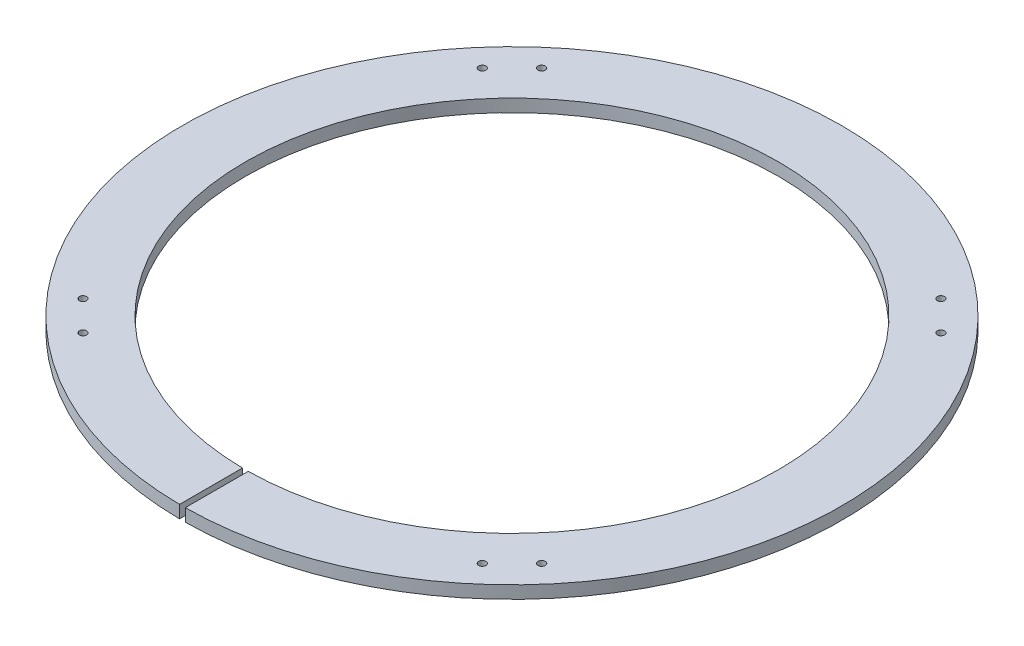
from build123d import *

# Parameters (mm, degrees)
SKETCH1_R           = 314
SKETCH1_R_2         = 254
BOSS_EXTRUDE1_DEPTH = 12
SKETCH2_W           = 5.489817528
SKETCH2_H           = 110.495913403
CUT_EXTRUDE1_DEPTH  = 445.22516813
SKETCH3_R           = 3.45
SCREW_HOLE_DEPTH    = 445.22516813
CIRPATTERN1_COUNT   = 4


with BuildPart() as part:
    # Sketch1 → Boss-Extrude1 (new body)
    with BuildSketch(Plane(origin=(0, 0, 0), x_dir=(1, 0, 0), z_dir=(0, 1, 0))):
        with Locations(Location((0, 0, 0), (0, 0, 270))):
            Circle(SKETCH1_R)
        with Locations(Location((0, 0, 0), (0, 0, 270))):
            Circle(SKETCH1_R_2, mode=Mode.SUBTRACT)
    extrude(amount=BOSS_EXTRUDE1_DEPTH)

    # Sketch2 → Cut-Extrude1 (cut, through all)
    with BuildSketch(Plane(origin=(0, 12, 0), x_dir=(1, 0, 0), z_dir=(0, 1, 0))):
        with Locations((0, -289.886753328)):
            Rectangle(SKETCH2_W, SKETCH2_H)
    extrude(amount=-CUT_EXTRUDE1_DEPTH, mode=Mode.SUBTRACT)

    # Sketch3 → screw hole (cut, through all)
    with BuildSketch(Plane(origin=(0, 12, 0), x_dir=(1, 0, 0), z_dir=(0, 1, 0))):
        with Locations(Location((190.211724139, -218.495995387, 0), (0, 0, 270))):
            Circle(SKETCH3_R)
        with Locations(Location((218.495995387, -190.211724139, 0), (0, 0, 270))):
            Circle(SKETCH3_R)
    screw_hole = extrude(amount=-SCREW_HOLE_DEPTH, mode=Mode.SUBTRACT)

    # CirPattern1: screw hole ×4 about axis
    cirpattern1_axis = Axis((0, 0, 0), (0, 1, 0))
    for i in range(1, CIRPATTERN1_COUNT):
        add(screw_hole.rotate(cirpattern1_axis, i * 360 / CIRPATTERN1_COUNT), mode=Mode.SUBTRACT)


solid = part.part
